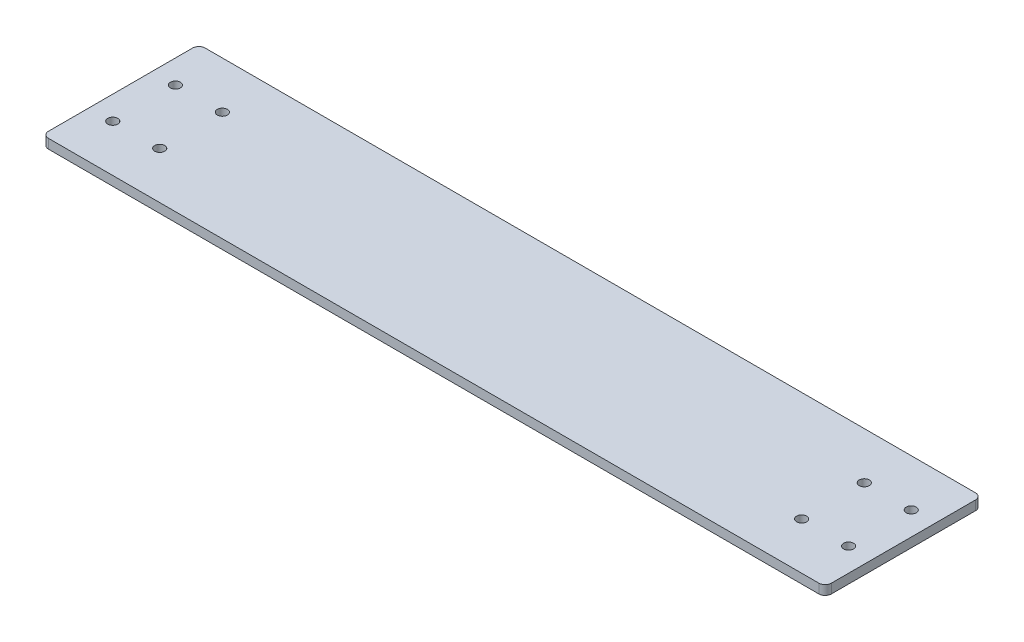
from build123d import *

# Parameters (mm, degrees)
SKETCH_1_W          = 250
SKETCH_1_H          = 50
EXTRUDE_1_DEPTH     = 3
CUT_EXTRUDE_1_REACH = 129.511
SKETCH_3_R          = 1.6
FILLET_1_R          = 2


with BuildPart() as part:
    # 草图1 → 凸台-拉伸1 (new body)
    with BuildSketch(Plane(origin=(0, 0, 0), x_dir=(1, 0, 0), z_dir=(0, 1, 0))):
        Rectangle(SKETCH_1_W, SKETCH_1_H)
    extrude(amount=EXTRUDE_1_DEPTH)

    # 草图3 → 切除-拉伸1 (cut, up to next)
    with BuildSketch(Plane(origin=(0, 3, 0), x_dir=(1, 0, 0), z_dir=(0, 1, 0)), mode=Mode.PRIVATE) as cut_extrude_1_sk1:
        with Locations(Location((-117.5, 10, 0), (0, 0, 270))):
            Circle(SKETCH_3_R)
    cut_extrude_1_tool1 = extrude(cut_extrude_1_sk1.sketch, amount=-CUT_EXTRUDE_1_REACH, mode=Mode.PRIVATE) & part.part
    # 草图3 → 切除-拉伸1 (cut, up to next)
    with BuildSketch(Plane(origin=(0, 3, 0), x_dir=(1, 0, 0), z_dir=(0, 1, 0)), mode=Mode.PRIVATE) as cut_extrude_1_sk2:
        with Locations(Location((-102.5, 10, 0), (0, 0, 270))):
            Circle(SKETCH_3_R)
    cut_extrude_1_tool2 = extrude(cut_extrude_1_sk2.sketch, amount=-CUT_EXTRUDE_1_REACH, mode=Mode.PRIVATE) & part.part
    # 草图3 → 切除-拉伸1 (cut, up to next)
    with BuildSketch(Plane(origin=(0, 3, 0), x_dir=(1, 0, 0), z_dir=(0, 1, 0)), mode=Mode.PRIVATE) as cut_extrude_1_sk3:
        with Locations(Location((-102.5, -10, 0), (0, 0, 270))):
            Circle(SKETCH_3_R)
    cut_extrude_1_tool3 = extrude(cut_extrude_1_sk3.sketch, amount=-CUT_EXTRUDE_1_REACH, mode=Mode.PRIVATE) & part.part
    # 草图3 → 切除-拉伸1 (cut, up to next)
    with BuildSketch(Plane(origin=(0, 3, 0), x_dir=(1, 0, 0), z_dir=(0, 1, 0)), mode=Mode.PRIVATE) as cut_extrude_1_sk4:
        with Locations(Location((-117.5, -10, 0), (0, 0, 270))):
            Circle(SKETCH_3_R)
    cut_extrude_1_tool4 = extrude(cut_extrude_1_sk4.sketch, amount=-CUT_EXTRUDE_1_REACH, mode=Mode.PRIVATE) & part.part
    # 草图3 → 切除-拉伸1 (cut, up to next)
    with BuildSketch(Plane(origin=(0, 3, 0), x_dir=(1, 0, 0), z_dir=(0, 1, 0)), mode=Mode.PRIVATE) as cut_extrude_1_sk5:
        with Locations(Location((117.5, -10, 0), (0, 0, 270))):
            Circle(SKETCH_3_R)
    cut_extrude_1_tool5 = extrude(cut_extrude_1_sk5.sketch, amount=-CUT_EXTRUDE_1_REACH, mode=Mode.PRIVATE) & part.part
    # 草图3 → 切除-拉伸1 (cut, up to next)
    with BuildSketch(Plane(origin=(0, 3, 0), x_dir=(1, 0, 0), z_dir=(0, 1, 0)), mode=Mode.PRIVATE) as cut_extrude_1_sk6:
        with Locations(Location((102.5, 10, 0), (0, 0, 270))):
            Circle(SKETCH_3_R)
    cut_extrude_1_tool6 = extrude(cut_extrude_1_sk6.sketch, amount=-CUT_EXTRUDE_1_REACH, mode=Mode.PRIVATE) & part.part
    # 草图3 → 切除-拉伸1 (cut, up to next)
    with BuildSketch(Plane(origin=(0, 3, 0), x_dir=(1, 0, 0), z_dir=(0, 1, 0)), mode=Mode.PRIVATE) as cut_extrude_1_sk7:
        with Locations(Location((117.5, 10, 0), (0, 0, 270))):
            Circle(SKETCH_3_R)
    cut_extrude_1_tool7 = extrude(cut_extrude_1_sk7.sketch, amount=-CUT_EXTRUDE_1_REACH, mode=Mode.PRIVATE) & part.part
    # 草图3 → 切除-拉伸1 (cut, up to next)
    with BuildSketch(Plane(origin=(0, 3, 0), x_dir=(1, 0, 0), z_dir=(0, 1, 0)), mode=Mode.PRIVATE) as cut_extrude_1_sk8:
        with Locations(Location((102.5, -10, 0), (0, 0, 270))):
            Circle(SKETCH_3_R)
    cut_extrude_1_tool8 = extrude(cut_extrude_1_sk8.sketch, amount=-CUT_EXTRUDE_1_REACH, mode=Mode.PRIVATE) & part.part
    add(cut_extrude_1_tool1.solids().sort_by_distance((-117.5, 3, -10))[0], mode=Mode.SUBTRACT)
    add(cut_extrude_1_tool2.solids().sort_by_distance((-102.5, 3, -10))[0], mode=Mode.SUBTRACT)
    add(cut_extrude_1_tool3.solids().sort_by_distance((-102.5, 3, 10))[0], mode=Mode.SUBTRACT)
    add(cut_extrude_1_tool4.solids().sort_by_distance((-117.5, 3, 10))[0], mode=Mode.SUBTRACT)
    add(cut_extrude_1_tool5.solids().sort_by_distance((117.5, 3, 10))[0], mode=Mode.SUBTRACT)
    add(cut_extrude_1_tool6.solids().sort_by_distance((102.5, 3, -10))[0], mode=Mode.SUBTRACT)
    add(cut_extrude_1_tool7.solids().sort_by_distance((117.5, 3, -10))[0], mode=Mode.SUBTRACT)
    add(cut_extrude_1_tool8.solids().sort_by_distance((102.5, 3, 10))[0], mode=Mode.SUBTRACT)

    # 圆角1
    fillet_1_edges = [part.edges().sort_by_distance(p)[0] for p in [
        (125, 1.5, 25),
        (-125, 1.5, 25),
        (-125, 1.5, -25),
        (125, 1.5, -25),
    ]]
    fillet(fillet_1_edges, radius=FILLET_1_R)


solid = part.part
